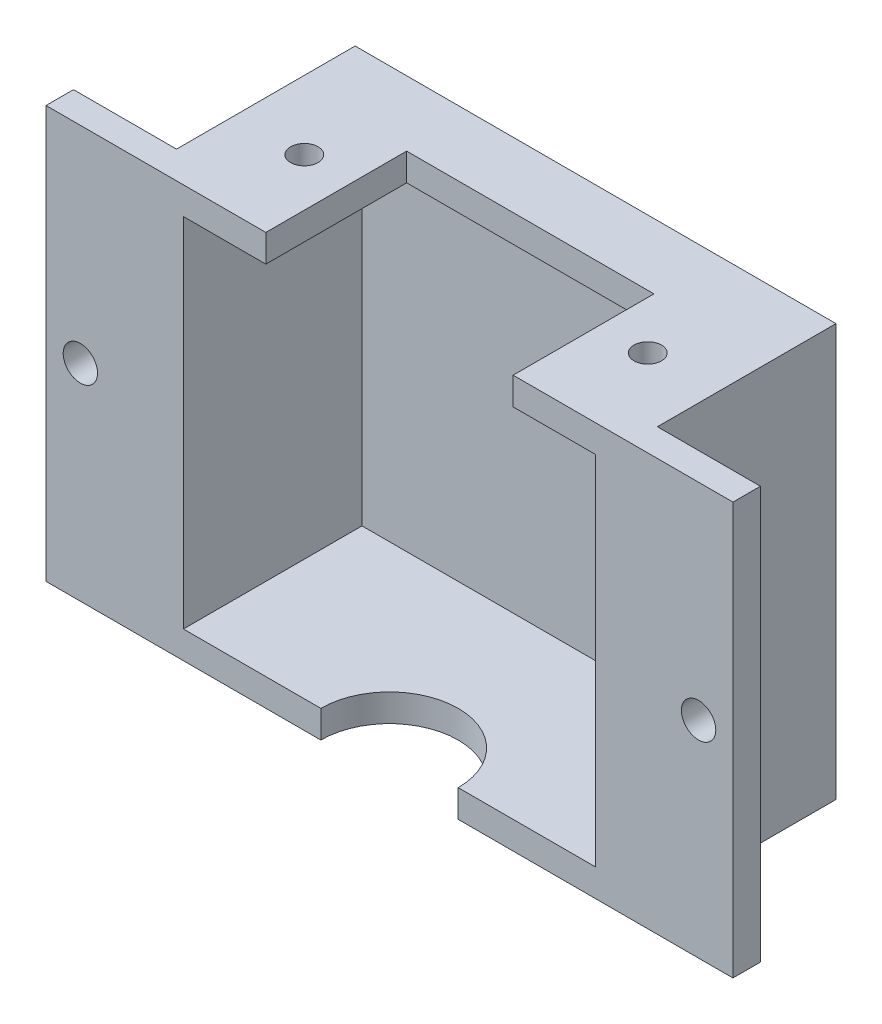
from build123d import *

# Parameters (mm, degrees)
SKETCH_1_W             = 50
SKETCH_1_H             = 30
EXTRUDE_1_DEPTH        = 15
SKETCH_2_W             = 18
SKETCH_2_H             = 10.25
CUT_EXTRUDE_1_DEPTH    = 5
SKETCH_3_W             = 30
SKETCH_3_H             = 26
CUT_EXTRUDE_2_DEPTH    = 13
SKETCH_4_W             = 7.5
SKETCH_4_H             = 13
CUT_EXTRUDE_3_DEPTH    = 50
SKETCH_5_W             = 7.5
SKETCH_5_H             = 13
CUT_EXTRUDE_4_DEPTH    = 50
CUT_EXTRUDE_5_DEPTH    = 50
SKETCH_7_R             = 1.25
CUT_EXTRUDE_6_DEPTH    = 50
PATTERN_LINEAR_1_COUNT = 2
PATTERN_LINEAR_1_PITCH = 45
SKETCH_8_R             = 1
CUT_EXTRUDE_7_DEPTH    = 5
PATTERN_LINEAR_2_COUNT = 2
PATTERN_LINEAR_2_PITCH = 25


with BuildPart() as part:
    # Эскиз1 → Бобышка-Вытянуть1 (new body)
    with BuildSketch(Plane.XY):
        Rectangle(SKETCH_1_W, SKETCH_1_H)
    extrude(amount=EXTRUDE_1_DEPTH)

    # Эскиз2 → Вырез-Вытянуть1 (cut)
    with BuildSketch(Plane(origin=(0, 15, 0), x_dir=(1, 0, 0), z_dir=(0, 1, 0))):
        with Locations((0, -9.875)):
            Rectangle(SKETCH_2_W, SKETCH_2_H)
    extrude(amount=-CUT_EXTRUDE_1_DEPTH, mode=Mode.SUBTRACT)

    # Эскиз3 → Вырез-Вытянуть2 (cut)
    with BuildSketch(Plane.XY.offset(15)):
        Rectangle(SKETCH_3_W, SKETCH_3_H)
    extrude(amount=-CUT_EXTRUDE_2_DEPTH, mode=Mode.SUBTRACT)

    # Эскиз4 → Вырез-Вытянуть3 (cut)
    with BuildSketch(Plane(origin=(0, 15, 0), x_dir=(1, 0, 0), z_dir=(0, 1, 0))):
        with Locations((-21.25, -6.5)):
            Rectangle(SKETCH_4_W, SKETCH_4_H)
    extrude(amount=-CUT_EXTRUDE_3_DEPTH, mode=Mode.SUBTRACT)

    # Эскиз5 → Вырез-Вытянуть4 (cut)
    with BuildSketch(Plane(origin=(0, 15, 0), x_dir=(1, 0, 0), z_dir=(0, 1, 0))):
        with Locations((21.25, -6.5)):
            Rectangle(SKETCH_5_W, SKETCH_5_H)
    extrude(amount=-CUT_EXTRUDE_4_DEPTH, mode=Mode.SUBTRACT)

    # Эскиз6 → Вырез-Вытянуть5 (cut)
    with BuildSketch(Plane.XZ.offset(15)):
        with BuildLine():
            Line((-5, 15), (5, 15))
            ThreePointArc((5, 15), (0, 10), (-5, 15))
        make_face()
    extrude(amount=-CUT_EXTRUDE_5_DEPTH, mode=Mode.SUBTRACT)

    # Эскиз7 → Вырез-Вытянуть6 (cut)
    with BuildSketch(Plane.XY.offset(15)):
        with Locations((22.5, 0)):
            Circle(SKETCH_7_R)
    cut_extrude_6 = extrude(amount=-CUT_EXTRUDE_6_DEPTH, mode=Mode.SUBTRACT)

    # Линейный массив1: Вырез-Вытянуть6 ×2
    with Locations(*[(-i * PATTERN_LINEAR_1_PITCH, 0, 0) for i in range(1, PATTERN_LINEAR_1_COUNT)]):
        add(cut_extrude_6, mode=Mode.SUBTRACT)

    # Эскиз8 → Вырез-Вытянуть7 (cut)
    with BuildSketch(Plane(origin=(0, 15, 0), x_dir=(1, 0, 0), z_dir=(0, 1, 0))):
        with Locations(Location((-12.5, -8.7, 0), (0, 0, 270))):
            Circle(SKETCH_8_R)
    cut_extrude_7 = extrude(amount=-CUT_EXTRUDE_7_DEPTH, mode=Mode.SUBTRACT)

    # Линейный массив2: Вырез-Вытянуть7 ×2
    with Locations(*[(i * PATTERN_LINEAR_2_PITCH, 0, 0) for i in range(1, PATTERN_LINEAR_2_COUNT)]):
        add(cut_extrude_7, mode=Mode.SUBTRACT)


solid = part.part
